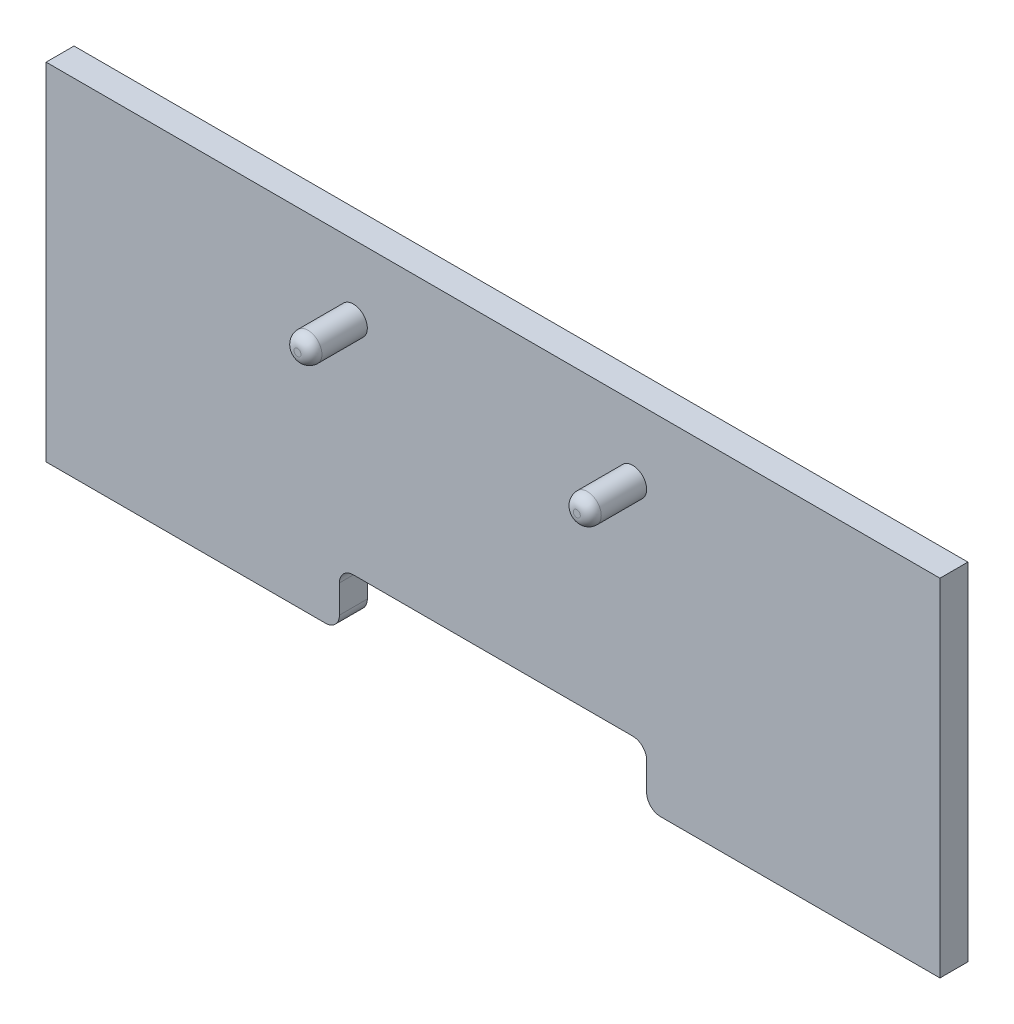
from build123d import *

# Parameters (mm, degrees)
SKETCH1_W           = 203.2
SKETCH1_H           = 78.7146
BOSS_EXTRUDE1_DEPTH = 6.35
SKETCH2_W           = 69.85
SKETCH2_H           = 12.7
CUT_EXTRUDE1_DEPTH  = 219.005850273
FILLET1_R           = 3.175
SKETCH3_R           = 3.175
BOSS_EXTRUDE2_DEPTH = 12.7
FILLET2_R           = 2.38125


with BuildPart() as part:
    # Sketch1 → Boss-Extrude1 (new body)
    with BuildSketch(Plane.XY):
        with Locations((101.6, 39.3573)):
            Rectangle(SKETCH1_W, SKETCH1_H)
    extrude(amount=BOSS_EXTRUDE1_DEPTH)

    # Sketch2 → Cut-Extrude1 (cut, through all)
    with BuildSketch(Plane.XY.offset(6.35)):
        with Locations((101.6, 6.35)):
            Rectangle(SKETCH2_W, SKETCH2_H)
    extrude(amount=-CUT_EXTRUDE1_DEPTH, mode=Mode.SUBTRACT)

    # Fillet1
    fillet1_edges = [part.edges().sort_by_distance(p)[0] for p in [
        (66.675, 0, 3.175),
        (66.675, 12.7, 3.175),
        (136.525, 12.7, 3.175),
        (136.525, 0, 3.175),
    ]]
    fillet(fillet1_edges, radius=FILLET1_R)

    # Sketch3 → Boss-Extrude2 (add)
    with BuildSketch(Plane.XY.offset(6.35)):
        with Locations(Location((69.85, 62.8396, 0), (0, 0, 180))):
            Circle(SKETCH3_R)
        with Locations(Location((133.35, 62.8396, 0), (0, 0, 180))):
            Circle(SKETCH3_R)
    extrude(amount=BOSS_EXTRUDE2_DEPTH)

    # Fillet2
    fillet2_edges = [part.edges().sort_by_distance(p)[0] for p in [
        (73.025, 62.8396, 19.05),
        (136.525, 62.8396, 19.05),
    ]]
    fillet(fillet2_edges, radius=FILLET2_R)


solid = part.part
